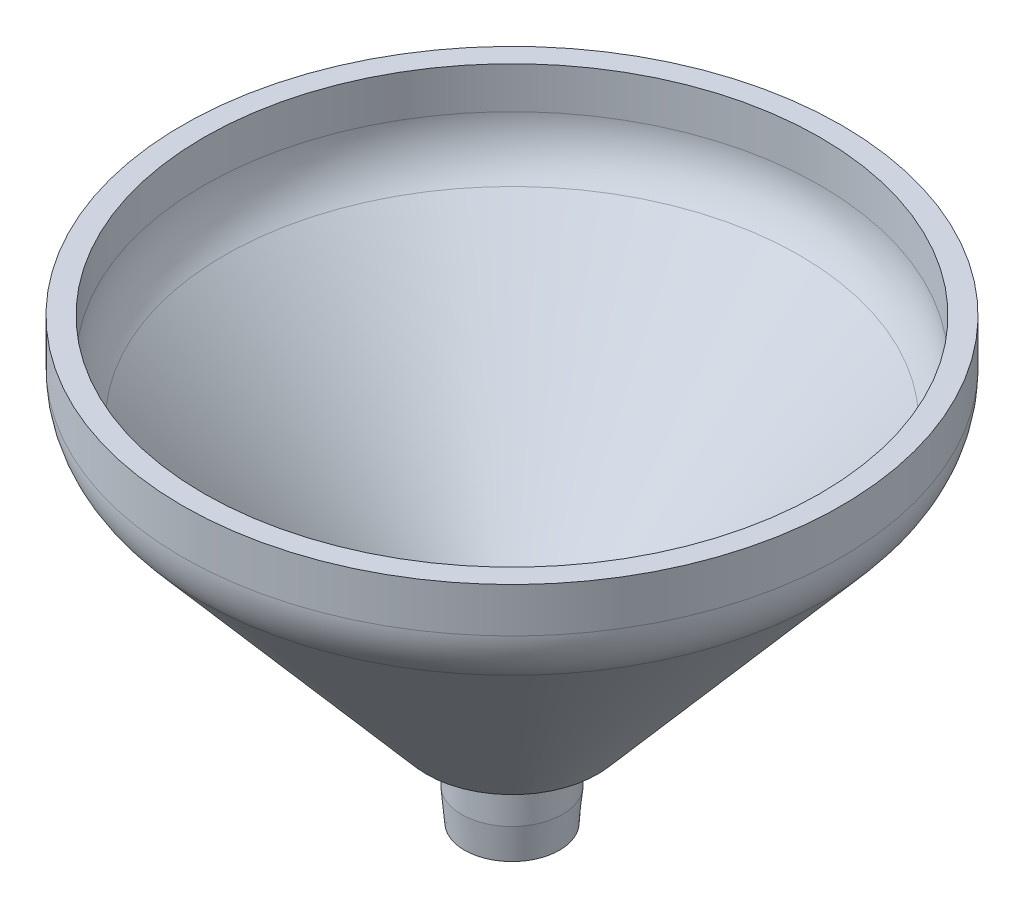
from build123d import *

# Parameters (mm, degrees)
FILLET1_R      = 10
CHAMFER1_SIZE  = 0.4
CHAMFER1_SIZE2 = 4.572020921


with BuildPart() as part:
    # Sketch1 → Revolve1 (revolve)
    with BuildSketch(Plane.XY, mode=Mode.PRIVATE) as revolve1_sk:
        Polygon((5.5, 0), (7.1, 0), (7.1, 12), (12.1, 12), (46.5, 52), (46.5, 62), (43.5, 62), (43.5, 52), (5.5, 14), align=None)
    revolve(revolve1_sk.sketch.rotate(Axis((0, 0, 0), (0, 1, 0)), 90), axis=Axis((0, 0, 0), (0, 1, 0)))

    # Fillet1
    fillet1_edges = [part.edges().sort_by_distance(p)[0] for p in [
        (0, 14, 5.5),
        (0, 52, 43.5),
        (0, 52, 46.5),
    ]]
    fillet(fillet1_edges, radius=FILLET1_R)

    # Chamfer1
    chamfer1_edges = [part.edges().sort_by_distance(p)[0] for p in [
        (0, 0, 7.1),
    ]]
    chamfer1_side = [part.faces().sort_by_distance(p)[0] for p in [
        (0, 0, 5.700818326),
    ]]
    chamfer(chamfer1_edges, length=CHAMFER1_SIZE, length2=CHAMFER1_SIZE2, reference=chamfer1_side[0])


solid = part.part
